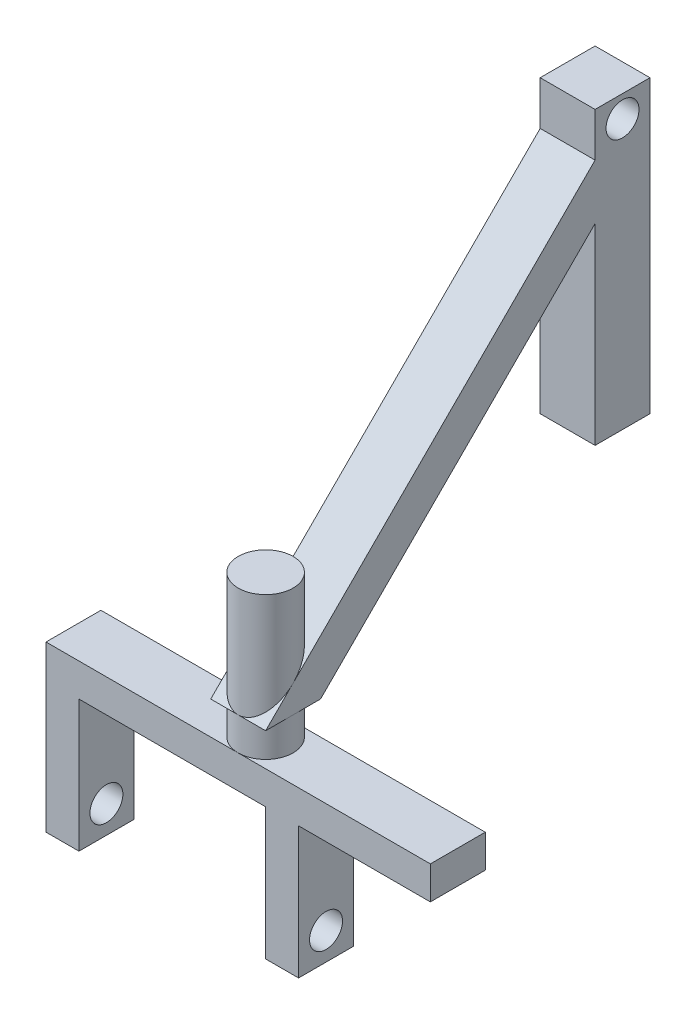
from build123d import *
from build123d.topology import SkipClean

# Parameters (mm, degrees)
SKETCH1_W            = 50
SKETCH1_H            = 300
BOSS_EXTRUDE1_DEPTH  = 50
SKETCH2_W            = 50
SKETCH2_H            = 75
CUT_EXTRUDE3_DEPTH   = 50
BOSS_EXTRUDE2_DEPTH  = 50
BOSS_EXTRUDE3_DEPTH  = 100
BOSS_EXTRUDE4_START  = 60
BOSS_EXTRUDE4_DEPTH  = 60
BOSS_EXTRUDE12_DEPTH = 30
SKETCH13_W           = 50
SKETCH13_H           = 150
BOSS_EXTRUDE13_DEPTH = 30
SKETCH14_W           = 30
SKETCH14_H           = 50
BOSS_EXTRUDE14_DEPTH = 120
CUT_EXTRUDE4_DEPTH   = 290
SKETCH17_W           = 50
SKETCH17_H           = 44.956964621
CUT_EXTRUDE5_DEPTH   = 50
SKETCH18_W           = 50
SKETCH18_H           = 50
BOSS_EXTRUDE15_DEPTH = 40
SKETCH19_R           = 15
CUT_EXTRUDE6_DEPTH   = 90


with BuildPart() as part:
    # Sketch1 → Boss-Extrude1 (new body)
    with BuildSketch(Plane.XY):
        with Locations((25, 150)):
            Rectangle(SKETCH1_W, SKETCH1_H)
    extrude(amount=BOSS_EXTRUDE1_DEPTH)

    # Sketch2 → Cut-Extrude3 (cut)
    with BuildSketch(Plane.ZY):
        with Locations((25, 37.5)):
            Rectangle(SKETCH2_W, SKETCH2_H)
    extrude(amount=-CUT_EXTRUDE3_DEPTH, mode=Mode.SUBTRACT)

    # Sketch4 → Boss-Extrude2 (add)
    with BuildSketch(Plane.ZY):
        Polygon((350, 0), (50, 300), (0, 344.956964621), (0, 300), (300, 0), align=None)
    extrude(amount=-BOSS_EXTRUDE2_DEPTH)

    # Sketch5 → Boss-Extrude3 (add)
    with BuildSketch(Plane.XZ):
        with BuildLine():
            ThreePointArc((50, 325), (42.67766953, 342.67766953), (25, 350))
            Line((25, 350), (25, 300))
            ThreePointArc((25, 300), (42.67766953, 307.32233047), (50, 325))
        make_face()
        with BuildLine():
            Line((25, 300), (25, 350))
            ThreePointArc((25, 350), (0, 325), (25, 300))
        make_face()
    extrude(amount=-BOSS_EXTRUDE3_DEPTH)

    # Sketch6 → Boss-Extrude4 (add)
    with BuildSketch(Plane.XZ.offset(BOSS_EXTRUDE4_START)):
        with BuildLine():
            ThreePointArc((50, 325), (42.67766953, 342.67766953), (25, 350))
            Line((25, 350), (25, 300))
            ThreePointArc((25, 300), (42.67766953, 307.32233047), (50, 325))
        make_face()
        with BuildLine():
            Line((25, 300), (25, 350))
            ThreePointArc((25, 350), (0, 325), (25, 300))
        make_face()
    extrude(amount=-BOSS_EXTRUDE4_DEPTH)

    # Sketch9 → Boss-Extrude12 (add)
    with BuildSketch(Plane.XZ.offset(60)):
        Polygon((50, 300), (0, 300), (-150, 300), (-150, 350), (0, 350), (50, 350), (200, 350), (200, 300), align=None)
    extrude(amount=-BOSS_EXTRUDE12_DEPTH)

    # Sketch13 → Boss-Extrude13 (add)
    with SkipClean():  # the faces are left unmerged after this step: merging them gives an invalid solid
        with BuildSketch(Plane.ZY.offset(150)):
            with Locations((325, -105)):
                Rectangle(SKETCH13_W, SKETCH13_H)
        extrude(amount=-BOSS_EXTRUDE13_DEPTH)

    # Sketch14 → Boss-Extrude14 (add)
    with SkipClean():  # the faces are left unmerged after this step: merging them gives an invalid solid
        with BuildSketch(Plane.XZ.offset(60)):
            with Locations((65, 325)):
                Rectangle(SKETCH14_W, SKETCH14_H)
        extrude(amount=BOSS_EXTRUDE14_DEPTH)

    # Sketch15 → Cut-Extrude4 (cut)
    with SkipClean():  # the faces are left unmerged after this step: merging them gives an invalid solid
        with BuildSketch(Plane.ZY.offset(150)):
            with BuildLine():
                ThreePointArc((325, -140), (310, -155), (325, -170))
                Line((325, -170), (325, -140))
            make_face()
            with BuildLine():
                Line((325, -140), (325, -170))
                ThreePointArc((325, -170), (335.606601718, -165.606601718), (340, -155))
                ThreePointArc((340, -155), (335.606601718, -144.393398282), (325, -140))
            make_face()
        extrude(amount=-CUT_EXTRUDE4_DEPTH, mode=Mode.SUBTRACT)

    # Sketch17 → Cut-Extrude5 (cut)
    with SkipClean():  # the faces are left unmerged after this step: merging them gives an invalid solid
        with BuildSketch(Plane.XY):
            with Locations((25, 322.47848231)):
                Rectangle(SKETCH17_W, SKETCH17_H)
        extrude(amount=CUT_EXTRUDE5_DEPTH, mode=Mode.SUBTRACT)

    # Sketch18 → Boss-Extrude15 (add)
    with SkipClean():  # the faces are left unmerged after this step: merging them gives an invalid solid
        with BuildSketch(Plane(origin=(0, 300, 0), x_dir=(1, 0, 0), z_dir=(0, 1, 0))):
            with Locations((25, -25)):
                Rectangle(SKETCH18_W, SKETCH18_H)
        extrude(amount=BOSS_EXTRUDE15_DEPTH)

    # Sketch19 → Cut-Extrude6 (cut)
    with SkipClean():  # the faces are left unmerged after this step: merging them gives an invalid solid
        with BuildSketch(Plane(origin=(50, 0, 0), x_dir=(0, 0, -1), z_dir=(1, 0, 0))):
            with Locations((-25, 320.076220665)):
                Circle(SKETCH19_R)
        extrude(amount=-CUT_EXTRUDE6_DEPTH, mode=Mode.SUBTRACT)


solid = part.part
